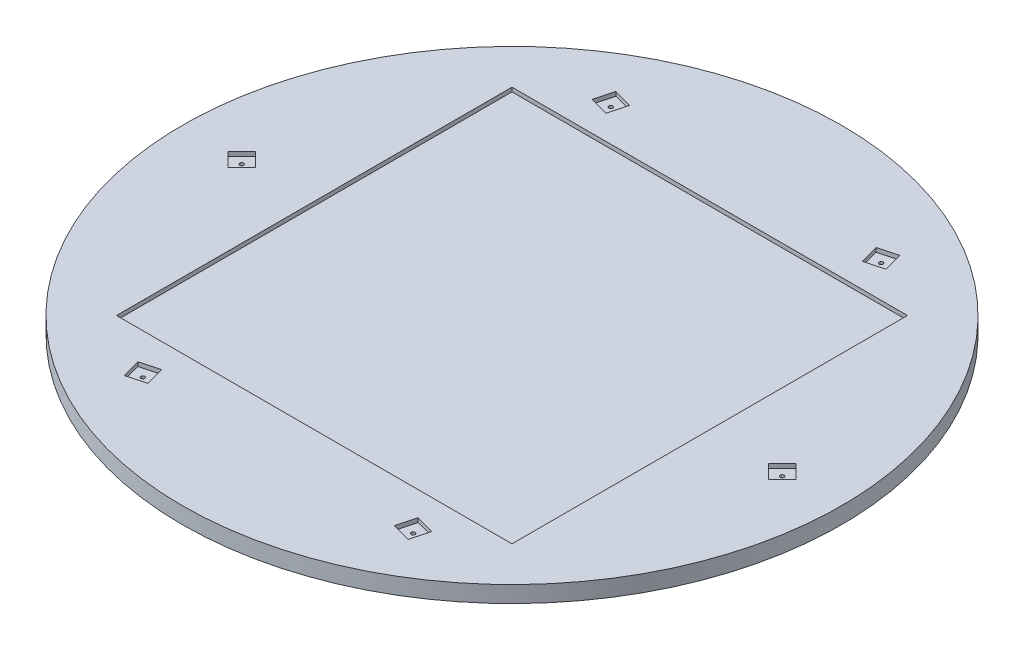
from build123d import *

# Parameters (mm, degrees)
SKETCH1_R           = 254
BOSS_EXTRUDE1_DEPTH = 12.7
SKETCH2_W           = 304.8
SKETCH2_H           = 304.8
CUT_EXTRUDE1_DEPTH  = 3.175
CUT_EXTRUDE2_DEPTH  = 3.175
SKETCH4_R           = 1.5
CUT_EXTRUDE3_DEPTH  = 360.434681131


with BuildPart() as part:
    # Sketch1 → Boss-Extrude1 (new body)
    with BuildSketch(Plane(origin=(0, 0, 0), x_dir=(1, 0, 0), z_dir=(0, 1, 0))):
        with Locations(Location((0, 0, 0), (0, 0, 270))):
            Circle(SKETCH1_R)
    extrude(amount=BOSS_EXTRUDE1_DEPTH)

    # Sketch2 → Cut-Extrude1 (cut)
    with BuildSketch(Plane(origin=(0, 12.7, 0), x_dir=(1, 0, 0), z_dir=(0, 1, 0))):
        Rectangle(SKETCH2_W, SKETCH2_H)
    extrude(amount=-CUT_EXTRUDE1_DEPTH, mode=Mode.SUBTRACT)

    # Sketch3 → Cut-Extrude2 (cut)
    with BuildSketch(Plane(origin=(0, 12.7, 0), x_dir=(1, 0, 0), z_dir=(0, 1, 0))):
        Polygon((94.954413465, 185.679071959), (98.836699141, 171.190184565), (113.325586535, 175.072470241), (109.443300859, 189.561357636), align=None)
        Polygon((218.886601718, 0), (208.28, 10.606601718), (197.673398282, 0), (208.28, -10.606601718), align=None)
        Polygon((109.443300859, -189.561357636), (113.325586535, -175.072470241), (98.836699141, -171.190184565), (94.954413465, -185.679071959), align=None)
        Polygon((-109.443300859, -189.561357636), (-94.954413465, -185.679071959), (-98.836699141, -171.190184565), (-113.325586535, -175.072470241), align=None)
        Polygon((-218.886601718, 0), (-208.28, -10.606601718), (-197.673398282, 0), (-208.28, 10.606601718), align=None)
        Polygon((-109.443300859, 189.561357636), (-113.325586535, 175.072470241), (-98.836699141, 171.190184565), (-94.954413465, 185.679071959), align=None)
    extrude(amount=-CUT_EXTRUDE2_DEPTH, mode=Mode.SUBTRACT)

    # Sketch4 → Cut-Extrude3 (cut, through all)
    with BuildSketch(Plane(origin=(0, 12.7, 0), x_dir=(1, 0, 0), z_dir=(0, 1, 0))):
        with Locations(Location((104.14, 180.3757711, 0), (0, 0, 270))):
            Circle(SKETCH4_R)
        with Locations(Location((208.28, 0, 0), (0, 0, 270))):
            Circle(SKETCH4_R)
        with Locations(Location((104.14, -180.3757711, 0), (0, 0, 270))):
            Circle(SKETCH4_R)
        with Locations(Location((-104.14, -180.3757711, 0), (0, 0, 270))):
            Circle(SKETCH4_R)
        with Locations(Location((-208.28, 0, 0), (0, 0, 270))):
            Circle(SKETCH4_R)
        with Locations(Location((-104.14, 180.3757711, 0), (0, 0, 270))):
            Circle(SKETCH4_R)
    extrude(amount=-CUT_EXTRUDE3_DEPTH, mode=Mode.SUBTRACT)


solid = part.part
